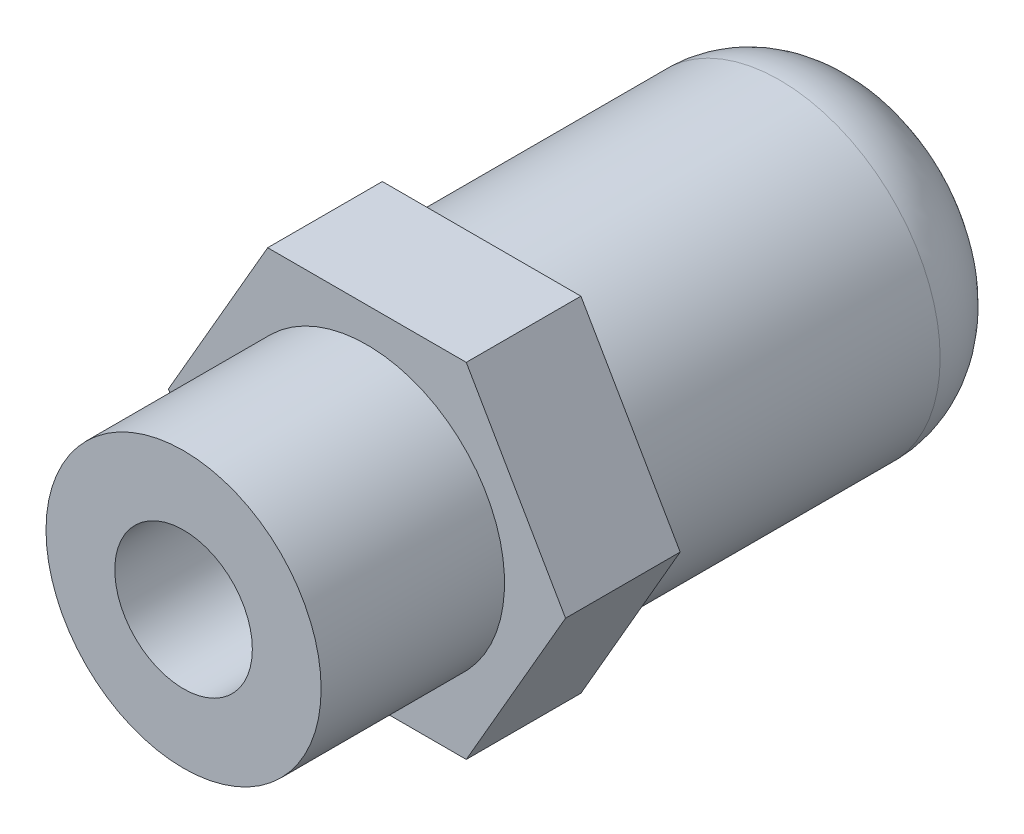
from build123d import *

# Parameters (mm, degrees)
SKICA1_R                 = 6
P_IDAT_VYSUNUT_M1_DEPTH  = 8
P_IDAT_VYSUNUT_M2_DEPTH  = 5
SKICA3_R                 = 7
P_IDAT_VYSUNUT_M3_DEPTH  = 17
ZAOBLIT1_R               = 4
SKICA4_R                 = 3
ODEBRAT_VYSUNUT_M1_DEPTH = 33.113081447


with BuildPart() as part:
    # Skica1 → Přidat vysunutím1 (new body)
    with BuildSketch(Plane.XY):
        Circle(SKICA1_R)
    extrude(amount=P_IDAT_VYSUNUT_M1_DEPTH)

    # Skica2 → Přidat vysunutím2 (add)
    with BuildSketch(Plane(origin=(0, 0, 0), x_dir=(-1, 0, 0), z_dir=(0, 0, -1))):
        Polygon((4.330127019, -7.5), (8.660254038, 0), (4.330127019, 7.5), (-4.330127019, 7.5), (-8.660254038, 0), (-4.330127019, -7.5), align=None)
    extrude(amount=P_IDAT_VYSUNUT_M2_DEPTH)

    # Skica3 → Přidat vysunutím3 (add)
    with BuildSketch(Plane(origin=(0, 0, -5), x_dir=(-1, 0, 0), z_dir=(0, 0, -1))):
        Circle(SKICA3_R)
    extrude(amount=P_IDAT_VYSUNUT_M3_DEPTH)

    # Zaoblit1
    zaoblit1_edges = [part.edges().sort_by_distance(p)[0] for p in [
        (7, 0, -22),
    ]]
    fillet(zaoblit1_edges, radius=ZAOBLIT1_R)

    # Skica4 → Odebrat vysunutím1 (cut, through all)
    with BuildSketch(Plane.XY.offset(8)):
        Circle(SKICA4_R)
    extrude(amount=-ODEBRAT_VYSUNUT_M1_DEPTH, mode=Mode.SUBTRACT)


solid = part.part
